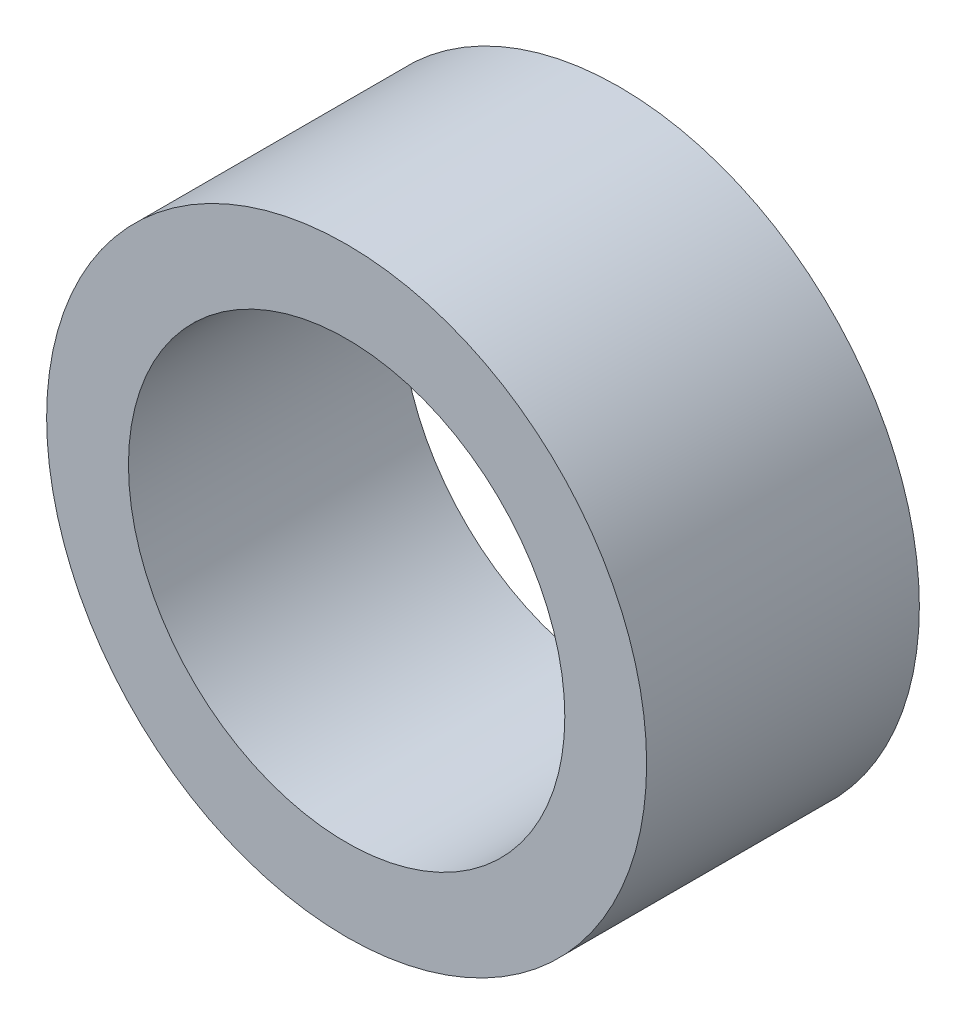
from build123d import *

# Parameters (mm, degrees)
SKETCH1_R           = 11
SKETCH1_R_2         = 8
BOSS_EXTRUDE1_DEPTH = 5


with BuildPart() as part:
    # Sketch1 → Boss-Extrude1 (new, symmetric)
    with BuildSketch(Plane.XY):
        Circle(SKETCH1_R)
        Circle(SKETCH1_R_2, mode=Mode.SUBTRACT)
    extrude(amount=BOSS_EXTRUDE1_DEPTH, both=True)


solid = part.part
